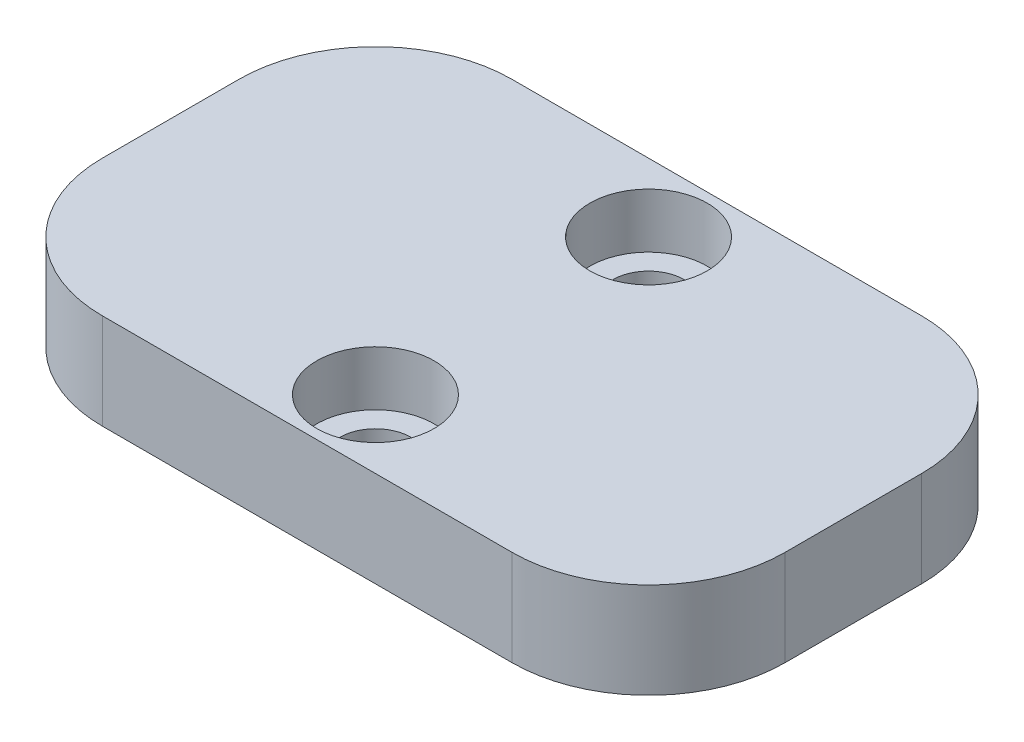
from build123d import *

# Parameters (mm, degrees)
SKETCH1_W           = 50
SKETCH1_H           = 30
SKETCH1_R           = 2.6
BOSS_EXTRUDE1_DEPTH = 7
FILLET1_R           = 10
SKETCH2_R           = 4.3
CUT_EXTRUDE1_DEPTH  = 4


with BuildPart() as part:
    # Sketch1 → Boss-Extrude1 (new body)
    with BuildSketch(Plane(origin=(0, 0, 0), x_dir=(1, 0, 0), z_dir=(0, 1, 0))):
        with Locations((25, 15)):
            Rectangle(SKETCH1_W, SKETCH1_H)
        with Locations(Location((25, 25, 0), (0, 0, 270))):
            Circle(SKETCH1_R, mode=Mode.SUBTRACT)
        with Locations(Location((25, 5, 0), (0, 0, 270))):
            Circle(SKETCH1_R, mode=Mode.SUBTRACT)
    extrude(amount=BOSS_EXTRUDE1_DEPTH)

    # Fillet1
    fillet1_edges = [part.edges().sort_by_distance(p)[0] for p in [
        (0, 3.5, -30),
        (50, 3.5, -30),
        (50, 3.5, 0),
        (0, 3.5, 0),
    ]]
    fillet(fillet1_edges, radius=FILLET1_R)

    # Sketch2 → Cut-Extrude1 (cut)
    with BuildSketch(Plane(origin=(0, 7, 0), x_dir=(1, 0, 0), z_dir=(0, 1, 0))):
        with Locations(Location((25, 25, 0), (0, 0, 270))):
            Circle(SKETCH2_R)
        with Locations(Location((25, 5, 0), (0, 0, 270))):
            Circle(SKETCH2_R)
    extrude(amount=-CUT_EXTRUDE1_DEPTH, mode=Mode.SUBTRACT)


solid = part.part
